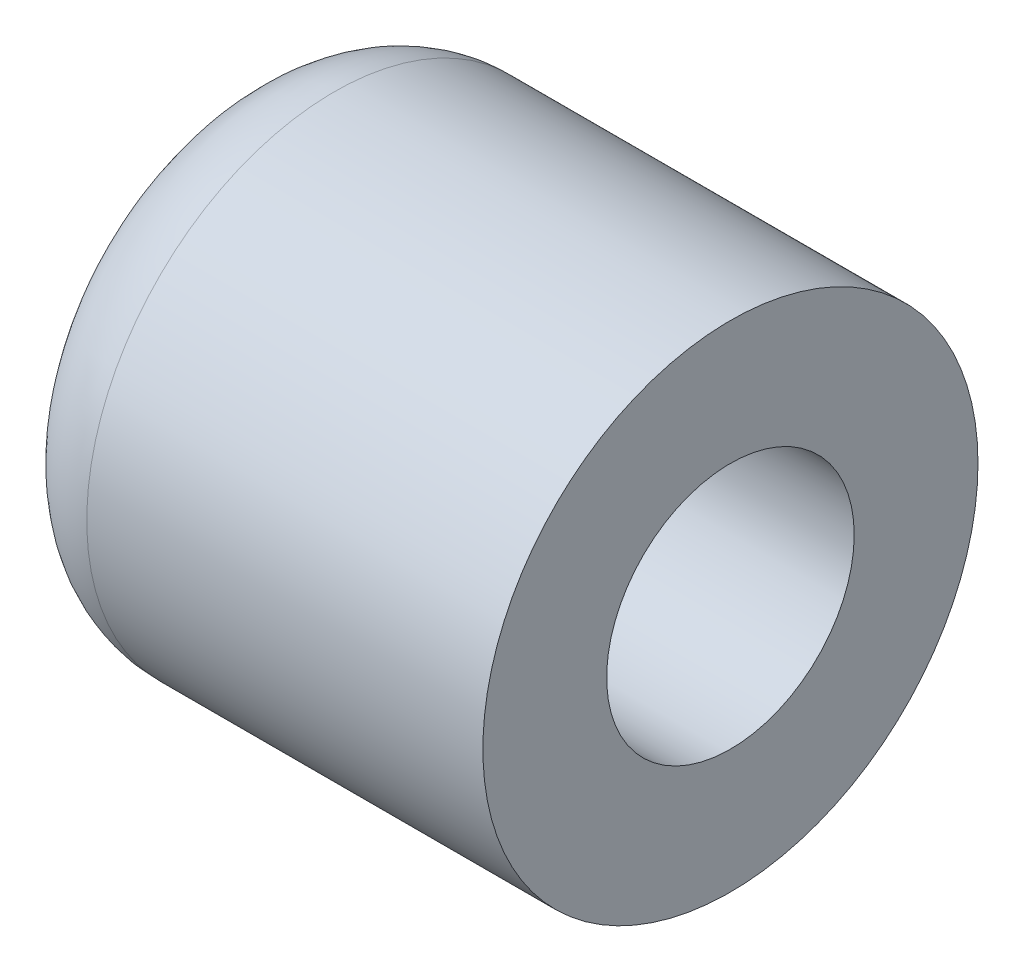
from build123d import *

# Parameters (mm, degrees)
SCHIZZO3_R                   = 5
ESTRUSIONE_ESTRUSIONE1_DEPTH = 10
RACCORDO1_R                  = 2
SCHIZZO4_R                   = 2.5
TAGLIO_ESTRUSIONE1_DEPTH     = 7


with BuildPart() as part:
    # Schizzo3 → Estrusione-Estrusione1 (new body)
    with BuildSketch(Plane(origin=(0, 0, 0), x_dir=(0, 0, -1), z_dir=(1, 0, 0))):
        Circle(SCHIZZO3_R)
    extrude(amount=ESTRUSIONE_ESTRUSIONE1_DEPTH)

    # Raccordo1
    raccordo1_edges = [part.edges().sort_by_distance(p)[0] for p in [
        (0, 0, 5),
    ]]
    fillet(raccordo1_edges, radius=RACCORDO1_R)

    # Schizzo4 → Taglio-Estrusione1 (cut)
    with BuildSketch(Plane(origin=(10, 0, 0), x_dir=(0, 0, -1), z_dir=(1, 0, 0))):
        Circle(SCHIZZO4_R)
    extrude(amount=-TAGLIO_ESTRUSIONE1_DEPTH, mode=Mode.SUBTRACT)


solid = part.part
